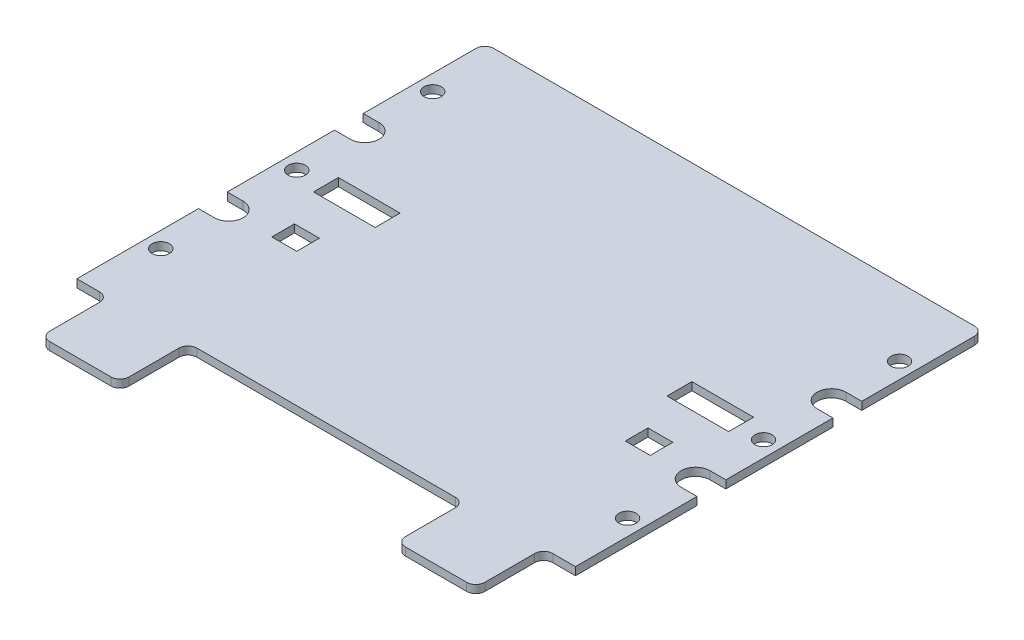
from build123d import *

# Parameters (mm, degrees)
FR4_DEPTH                     = 1.7526
SKETCH6_W                     = 5.5
SKETCH6_H                     = 5
SKETCH6_W_2                   = 13.6
SKETCH6_H_2                   = 5.5
FIBER_TRANSCEIVER_SLOTS_DEPTH = 143.1375095
SKETCH7_R                     = 1.905
CUT_EXTRUDE1_DEPTH            = 143.1375095
SKETCH8_R                     = 3.175
CUT_EXTRUDE2_DEPTH            = 143.1375095
CUT_EXTRUDE3_DEPTH            = 143.1375095


with BuildPart() as part:
    # Sketch1 → FR4 (new body)
    with BuildSketch(Plane(origin=(0, 0, 0), x_dir=(1, 0, 0), z_dir=(0, 1, 0))):
        with BuildLine():
            Line((0, 0), (5, 0))
            ThreePointArc((5, 0), (6.414213562, -0.585786438), (7, -2))
            Line((7, -2), (7, -13))
            ThreePointArc((7, -13), (7.585786438, -14.414213562), (9, -15))
            Line((9, -15), (22.5, -15))
            ThreePointArc((22.5, -15), (23.914213562, -14.414213562), (24.5, -13))
            Line((24.5, -13), (24.5, -2))
            ThreePointArc((24.5, -2), (25.085786438, -0.585786438), (26.5, 0))
            Line((26.5, 0), (83.5, 0))
            ThreePointArc((83.5, 0), (84.914213562, -0.585786438), (85.5, -2))
            Line((85.5, -2), (85.5, -13))
            ThreePointArc((85.5, -13), (86.085786438, -14.414213562), (87.5, -15))
            Line((87.5, -15), (101, -15))
            ThreePointArc((101, -15), (102.414213562, -14.414213562), (103, -13))
            Line((103, -13), (103, -2))
            ThreePointArc((103, -2), (103.585786438, -0.585786438), (105, 0))
            Line((105, 0), (110, 0))
            Line((110, 0), (110, 88))
            ThreePointArc((110, 88), (109.414213562, 89.414213562), (108, 90))
            Line((108, 90), (2, 90))
            ThreePointArc((2, 90), (0.585786438, 89.414213562), (0, 88))
            Line((0, 88), (0, 0))
        make_face()
    extrude(amount=FR4_DEPTH)

    # Sketch6 → fiber-transceiver-slots (cut, through all)
    with BuildSketch(Plane(origin=(0, 1.7526, 0), x_dir=(1, 0, 0), z_dir=(0, 1, 0))):
        with Locations((16.25, 32)):
            Rectangle(SKETCH6_W, SKETCH6_H)
        with Locations((94.25, 32)):
            Rectangle(SKETCH6_W, SKETCH6_H)
        with Locations((94.3, 45.45)):
            Rectangle(SKETCH6_W_2, SKETCH6_H_2)
        with Locations((16.3, 45.45)):
            Rectangle(SKETCH6_W_2, SKETCH6_H_2)
    extrude(amount=-FIBER_TRANSCEIVER_SLOTS_DEPTH, mode=Mode.SUBTRACT)

    # Sketch7 → Cut-Extrude1 (cut, through all)
    with BuildSketch(Plane(origin=(0, 1.7526, 0), x_dir=(1, 0, 0), z_dir=(0, 1, 0))):
        with Locations(Location((3.5, 15, 0), (0, 0, 270))):
            Circle(SKETCH7_R)
        with Locations(Location((106.5, 15, 0), (0, 0, 270))):
            Circle(SKETCH7_R)
        with Locations(Location((106.5, 30, 0), (0, 0, 270))):
            Circle(SKETCH7_R)
        with Locations(Location((106.5, 45, 0), (0, 0, 270))):
            Circle(SKETCH7_R)
        with Locations(Location((106.5, 60, 0), (0, 0, 270))):
            Circle(SKETCH7_R)
        with Locations(Location((106.5, 75, 0), (0, 0, 270))):
            Circle(SKETCH7_R)
        with Locations(Location((3.5, 30, 0), (0, 0, 270))):
            Circle(SKETCH7_R)
        with Locations(Location((3.5, 45, 0), (0, 0, 270))):
            Circle(SKETCH7_R)
        with Locations(Location((3.5, 60, 0), (0, 0, 270))):
            Circle(SKETCH7_R)
        with Locations(Location((3.5, 75, 0), (0, 0, 270))):
            Circle(SKETCH7_R)
    extrude(amount=-CUT_EXTRUDE1_DEPTH, mode=Mode.SUBTRACT)

    # Sketch8 → Cut-Extrude2 (cut, through all)
    with BuildSketch(Plane(origin=(0, 1.7526, 0), x_dir=(1, 0, 0), z_dir=(0, 1, 0))):
        with Locations(Location((3.5, 30, 0), (0, 0, 270))):
            Circle(SKETCH8_R)
        with Locations(Location((3.5, 60, 0), (0, 0, 270))):
            Circle(SKETCH8_R)
        with Locations(Location((106.5, 60, 0), (0, 0, 270))):
            Circle(SKETCH8_R)
        with Locations(Location((106.5, 30, 0), (0, 0, 270))):
            Circle(SKETCH8_R)
    extrude(amount=-CUT_EXTRUDE2_DEPTH, mode=Mode.SUBTRACT)

    # Sketch9 → Cut-Extrude3 (cut, through all)
    with BuildSketch(Plane(origin=(0, 1.7526, 0), x_dir=(1, 0, 0), z_dir=(0, 1, 0))):
        with BuildLine():
            Line((0, 63.175), (3.5, 63.175))
            ThreePointArc((3.5, 63.175), (6.675, 60), (3.5, 56.825))
            Line((3.5, 56.825), (0, 56.825))
            Line((0, 56.825), (0, 63.175))
        make_face()
        with BuildLine():
            Line((0, 33.175), (3.5, 33.175))
            ThreePointArc((3.5, 33.175), (6.675, 30), (3.5, 26.825))
            Line((3.5, 26.825), (0, 26.825))
            Line((0, 26.825), (0, 33.175))
        make_face()
        with BuildLine():
            Line((110, 63.175), (106.5, 63.175))
            ThreePointArc((106.5, 63.175), (103.325, 60), (106.5, 56.825))
            Line((106.5, 56.825), (110, 56.825))
            Line((110, 56.825), (110, 63.175))
        make_face()
        with BuildLine():
            Line((110, 33.175), (106.5, 33.175))
            ThreePointArc((106.5, 33.175), (103.325, 30), (106.5, 26.825))
            Line((106.5, 26.825), (110, 26.825))
            Line((110, 26.825), (110, 33.175))
        make_face()
    extrude(amount=-CUT_EXTRUDE3_DEPTH, mode=Mode.SUBTRACT)


solid = part.part
